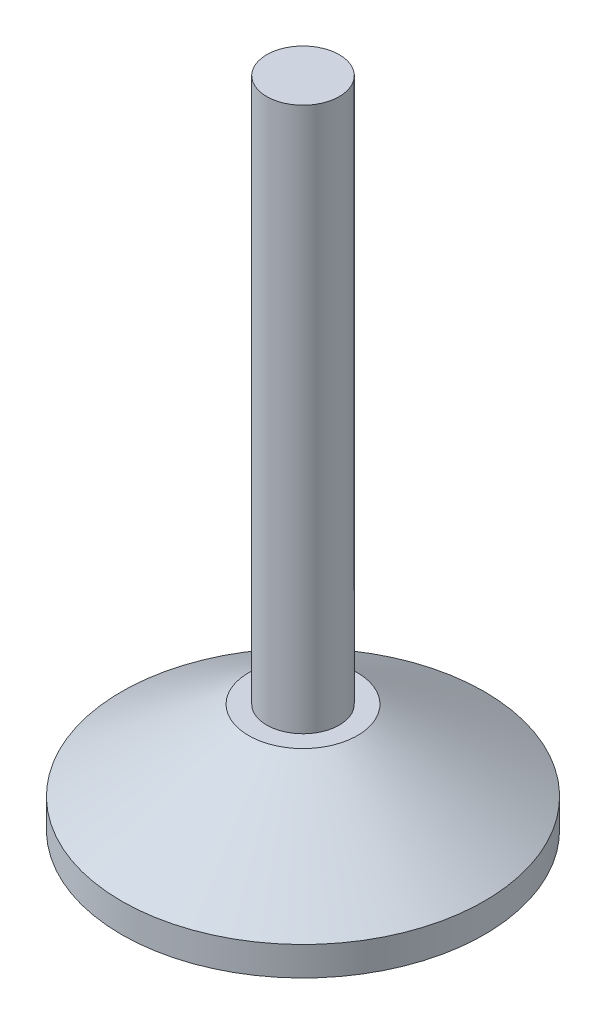
from build123d import *


with BuildPart() as part:
    # 草图1 → 旋转1 (revolve)
    with BuildSketch(Plane.XY, mode=Mode.PRIVATE) as revolve_1_sk:
        Polygon((0, 0), (0, 180), (10, 180), (10, 30), (15, 30), (50, 8), (50, 0), align=None)
    revolve(revolve_1_sk.sketch.rotate(Axis((0, 0, 0), (0, 1, 0)), 90), axis=Axis((0, 0, 0), (0, 1, 0)))


solid = part.part
